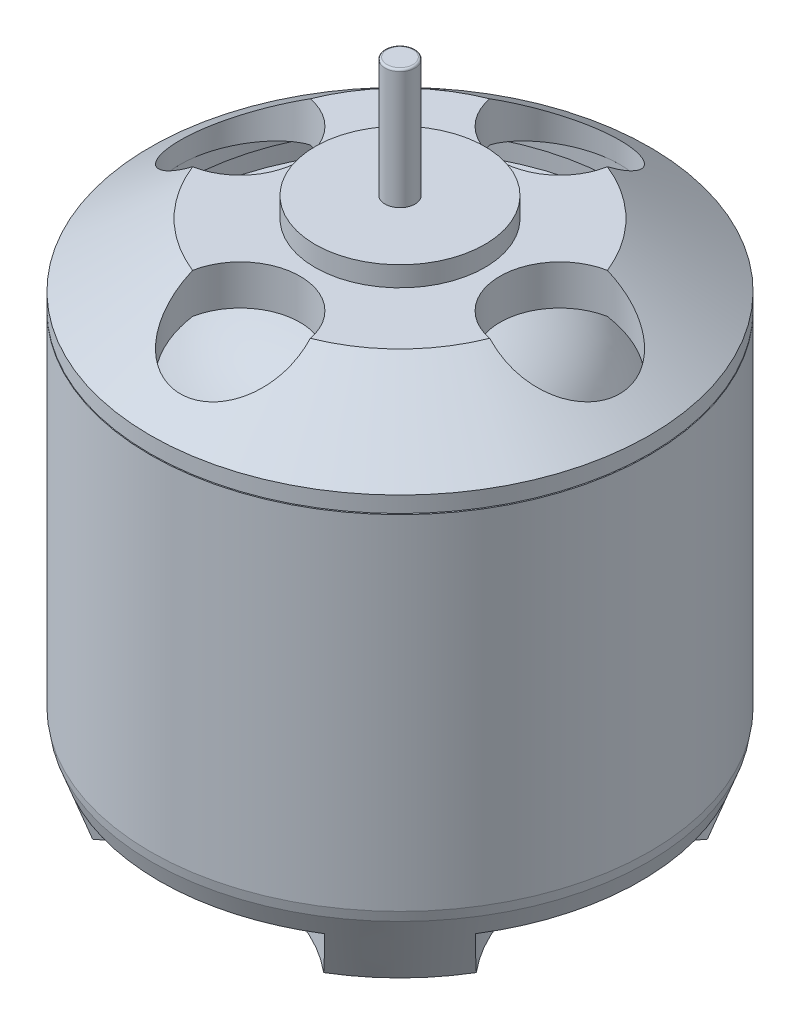
from build123d import *

# Parameters (mm, degrees)
SKETCH2_OUTSIDE_W   = 35.778
SKETCH2_OUTSIDE_H   = 35.778
SKETCH2_OUTSIDE_R   = 1.25
CUT_EXTRUDE2_DEPTH  = 2.3
CUT_EXTRUDE3_REACH  = 32.619
SKETCH3_R           = 3
SKETCH4_W           = 1
SKETCH4_H           = 17.2
SKETCH4_W_2         = 0.75
SKETCH4_H_2         = 33
FILLET1_R           = 0.1
SKETCH7_W           = 1.5
SKETCH7_H           = 15
BOSS_EXTRUDE1_DEPTH = 1
SKETCH10_W          = 3.5
SKETCH10_H          = 9
BOSS_EXTRUDE2_DEPTH = 1.5


with BuildPart() as part:
    # Sketch1 → Revolve1 (revolve)
    with BuildSketch(Plane.XY, mode=Mode.PRIVATE) as revolve1_sk:
        Polygon((0.75, -1.8), (9.656441102, -1.8), (10.91183651, -0.5), (11, 0), (12.5, 0), (12.41183651, -0.5), (11.210734737, -3.8), (3.5, -3.8), (3, -3.317155613), (0.75, -3.317155613), align=None)
        Polygon((11, 17.249066078), (12.5, 17.249066078), (12.5, 18.049066078), (8, 21.2), (4.25, 21.2), (4.25, 22.2), (0.75, 22.2), (0.75, 19.2), (8, 19.2), (11, 18.049066078), align=None)
    revolve(revolve1_sk.sketch.rotate(Axis((0, 31.924400062, 0), (0, -1, 0)), 90), axis=Axis((0, 31.924400062, 0), (0, -1, 0)))

    # Sketch2 outside → Cut-Extrude2 (cut)
    # profile 1 of 5: a face of its own
    with BuildSketch(Plane.XZ.offset(3.8)):
        Rectangle(SKETCH2_OUTSIDE_W, SKETCH2_OUTSIDE_H)
        with BuildLine():
            ThreePointArc((-6.675602022, 10.463748047), (-8.776493763, 8.776493763), (-10.463748047, 6.675602022))
            ThreePointArc((-10.463748047, 6.675602022), (-7.5, 0), (-10.463748047, -6.675602022))
            ThreePointArc((-10.463748047, -6.675602022), (-8.776493763, -8.776493763), (-6.675602022, -10.463748047))
            ThreePointArc((-6.675602022, -10.463748047), (0, -7.5), (6.675602022, -10.463748047))
            ThreePointArc((6.675602022, -10.463748047), (8.776493763, -8.776493763), (10.463748047, -6.675602022))
            ThreePointArc((10.463748047, -6.675602022), (7.5, 0), (10.463748047, 6.675602022))
            ThreePointArc((10.463748047, 6.675602022), (8.776493763, 8.776493763), (6.675602022, 10.463748047))
            ThreePointArc((6.675602022, 10.463748047), (0, 7.5), (-6.675602022, 10.463748047))
        make_face(mode=Mode.SUBTRACT)
    # profile 2 of 5: a face of its own
    with BuildSketch(Plane.XZ.offset(3.8)):
        with Locations(Location((5.303300859, 5.303300859, 0), (0, 0, 270))):
            Circle(SKETCH2_OUTSIDE_R)
    # profile 3 of 5: a face of its own
    with BuildSketch(Plane.XZ.offset(3.8)):
        with Locations(Location((5.303300859, -5.303300859, 0), (0, 0, 270))):
            Circle(SKETCH2_OUTSIDE_R)
    # profile 4 of 5: a face of its own
    with BuildSketch(Plane.XZ.offset(3.8)):
        with Locations(Location((-5.303300859, -5.303300859, 0), (0, 0, 270))):
            Circle(SKETCH2_OUTSIDE_R)
    # profile 5 of 5: a face of its own
    with BuildSketch(Plane.XZ.offset(3.8)):
        with Locations(Location((-5.303300859, 5.303300859, 0), (0, 0, 270))):
            Circle(SKETCH2_OUTSIDE_R)
    extrude(amount=-CUT_EXTRUDE2_DEPTH, mode=Mode.SUBTRACT)

    # Sketch3 → Cut-Extrude3 (cut, up to next)
    with BuildSketch(Plane(origin=(0, 21.2, 0), x_dir=(1, 0, 0), z_dir=(0, 1, 0)), mode=Mode.PRIVATE) as cut_extrude3_sk1:
        with Locations(Location((8, 0, 0), (0, 0, 259.193077125))):
            Circle(SKETCH3_R)
    cut_extrude3_tool1 = extrude(cut_extrude3_sk1.sketch, amount=-CUT_EXTRUDE3_REACH, mode=Mode.PRIVATE) & part.part
    # Sketch3 → Cut-Extrude3 (cut, up to next)
    with BuildSketch(Plane(origin=(0, 21.2, 0), x_dir=(1, 0, 0), z_dir=(0, 1, 0)), mode=Mode.PRIVATE) as cut_extrude3_sk2:
        with Locations(Location((0, -8, 0), (0, 0, 169.193077125))):
            Circle(SKETCH3_R)
    cut_extrude3_tool2 = extrude(cut_extrude3_sk2.sketch, amount=-CUT_EXTRUDE3_REACH, mode=Mode.PRIVATE) & part.part
    # Sketch3 → Cut-Extrude3 (cut, up to next)
    with BuildSketch(Plane(origin=(0, 21.2, 0), x_dir=(1, 0, 0), z_dir=(0, 1, 0)), mode=Mode.PRIVATE) as cut_extrude3_sk3:
        with Locations(Location((-8, 0, 0), (0, 0, 280.806922991))):
            Circle(SKETCH3_R)
    cut_extrude3_tool3 = extrude(cut_extrude3_sk3.sketch, amount=-CUT_EXTRUDE3_REACH, mode=Mode.PRIVATE) & part.part
    # Sketch3 → Cut-Extrude3 (cut, up to next)
    with BuildSketch(Plane(origin=(0, 21.2, 0), x_dir=(1, 0, 0), z_dir=(0, 1, 0)), mode=Mode.PRIVATE) as cut_extrude3_sk4:
        with Locations(Location((0, 8, 0), (0, 0, 190.806922991))):
            Circle(SKETCH3_R)
    cut_extrude3_tool4 = extrude(cut_extrude3_sk4.sketch, amount=-CUT_EXTRUDE3_REACH, mode=Mode.PRIVATE) & part.part
    add(cut_extrude3_tool1.solids().sort_by_distance((8, 21.2, 0))[0], mode=Mode.SUBTRACT)
    add(cut_extrude3_tool2.solids().sort_by_distance((0, 21.2, 8))[0], mode=Mode.SUBTRACT)
    add(cut_extrude3_tool3.solids().sort_by_distance((-8, 21.2, 0))[0], mode=Mode.SUBTRACT)
    add(cut_extrude3_tool4.solids().sort_by_distance((0, 21.2, -8))[0], mode=Mode.SUBTRACT)

    # Sketch4 → Revolve3 (revolve)
    with BuildSketch(Plane.XY, mode=Mode.PRIVATE) as revolve3_sk:
        with Locations((12, 8.6)):
            Rectangle(SKETCH4_W, SKETCH4_H)
        with Locations((0.375, 11.7)):
            Rectangle(SKETCH4_W_2, SKETCH4_H_2)
    revolve(revolve3_sk.sketch.rotate(Axis((0, 33.988505782, 0), (0, -1, 0)), 90), axis=Axis((0, 33.988505782, 0), (0, -1, 0)))

    # Sketch5 → Revolve4 (revolve)
    with BuildSketch(Plane.XY, mode=Mode.PRIVATE) as revolve4_sk:
        Polygon((0.75, -0.8), (0.75, 18.7), (1.75, 18.7), (1.75, 0.4), (5.75, 0.4), (5.75, -0.8), align=None)
    revolve(revolve4_sk.sketch.rotate(Axis((0, 36.924181462, 0), (0, -1, 0)), 90), axis=Axis((0, 36.924181462, 0), (0, -1, 0)))

    # Sketch6 → Revolve6 (revolve)
    with BuildSketch(Plane.XY, mode=Mode.PRIVATE) as revolve6_sk:
        with BuildLine():
            Line((1.75, 18.7), (1.75, 0.4))
            Line((1.75, 0.4), (3.75, 0.4))
            add(Edge.make_bspline(
                [(1.75, 18.7), (2.306786628, 19.23210848), (11.042671841, 18.652075425), (9.502384644, 6.438232094), (7.32575928, 2.787085766), (4.634939513, 0.4), (3.75, 0.4)],
                knots=[0, 0, 0, 0, 0.314781846, 0.817368327, 0.885890143, 1, 1, 1, 1], degree=3))
        make_face()
    revolve(revolve6_sk.sketch.rotate(Axis((0, 36.924181462, 0), (0, -1, 0)), 248.38615425), axis=Axis((0, 36.924181462, 0), (0, -1, 0)))

    # Fillet1
    fillet1_edges = [part.edges().sort_by_distance(p)[0] for p in [
        (0, -4.8, -0.75),
        (0, 28.2, -0.75),
    ]]
    fillet(fillet1_edges, radius=FILLET1_R)

    # Sketch7 → Revolve7 (revolve)
    with BuildSketch(Plane.XY, mode=Mode.PRIVATE) as revolve7_sk:
        with Locations((10.75, 8.5)):
            Rectangle(SKETCH7_W, SKETCH7_H)
    revolve(revolve7_sk.sketch.rotate(Axis((0, 32.549865017, 0), (0, -1, 0)), 90), axis=Axis((0, 32.549865017, 0), (0, -1, 0)))

    # Sketch9 → Boss-Extrude1 (add)
    with BuildSketch(Plane.XZ.offset(0.8)):
        with BuildLine():
            Line((-9, -3.5), (0, -3.5))
            Line((0, -3.5), (0, 3.5))
            Line((0, 3.5), (-9, 3.5))
            ThreePointArc((-9, 3.5), (-9.708438024, 0), (-9, -3.5))
        make_face()
    extrude(amount=BOSS_EXTRUDE1_DEPTH)

    # Sketch10 → Boss-Extrude2 (add)
    with BuildSketch(Plane.XZ.offset(1.8)):
        with Locations((-10.75, 0)):
            Rectangle(SKETCH10_W, SKETCH10_H)
    extrude(amount=BOSS_EXTRUDE2_DEPTH)


solid = part.part
